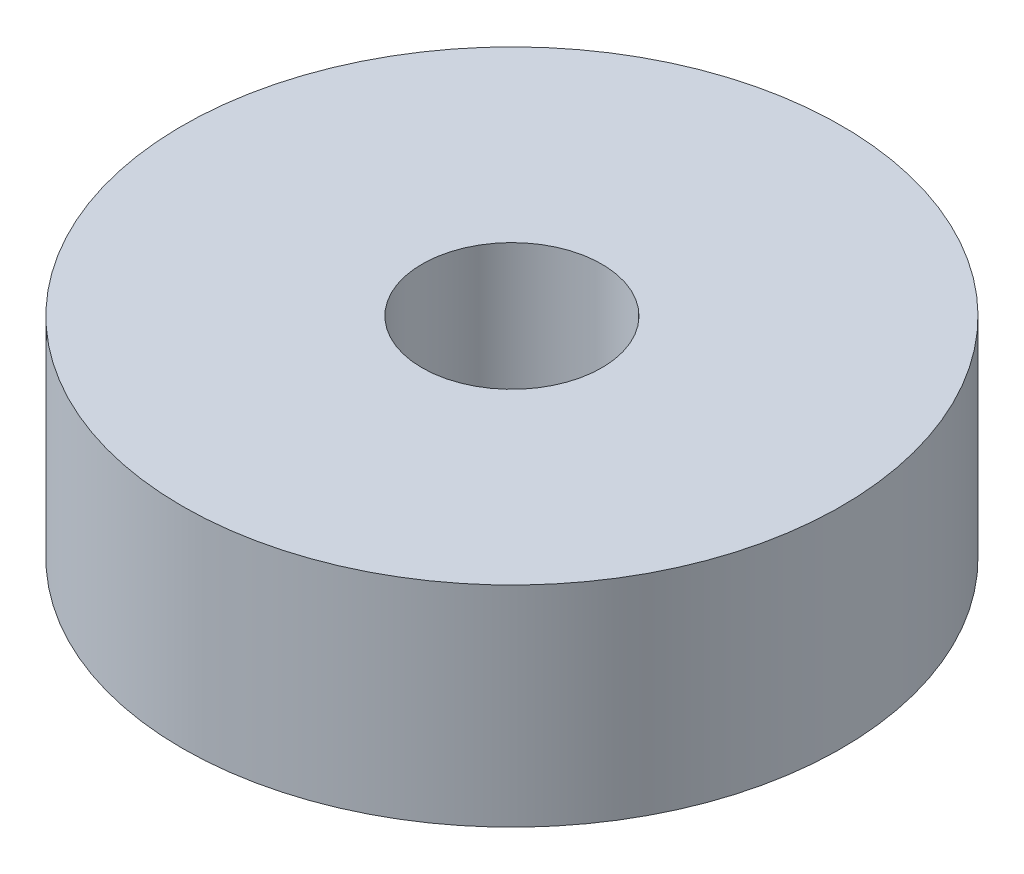
from build123d import *

# Parameters (mm, degrees)
SKETCH_1_R      = 11
SKETCH_1_R_2    = 3
EXTRUDE_1_DEPTH = 7


with BuildPart() as part:
    # 草图1 → 凸台-拉伸1 (new body)
    with BuildSketch(Plane(origin=(0, 0, 0), x_dir=(1, 0, 0), z_dir=(0, 1, 0))):
        with Locations(Location((0, 0, 0), (0, 0, 270))):
            Circle(SKETCH_1_R)
        with Locations(Location((0, 0, 0), (0, 0, 270))):
            Circle(SKETCH_1_R_2, mode=Mode.SUBTRACT)
    extrude(amount=EXTRUDE_1_DEPTH)


solid = part.part
